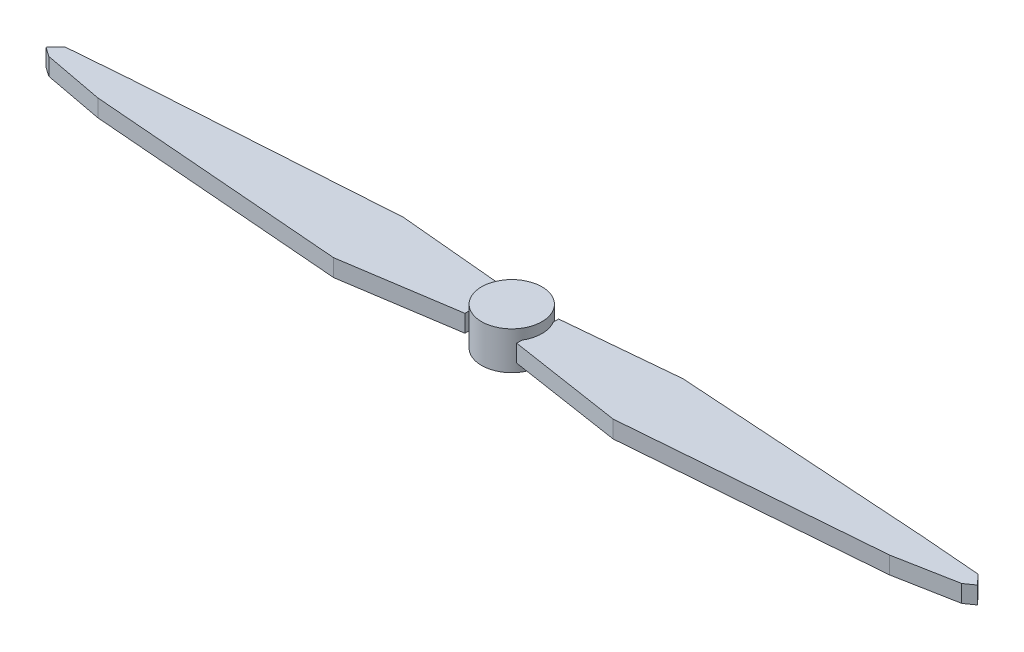
from build123d import *

# Parameters (mm, degrees)
BOSS_EXTRUDE1_DEPTH   = 4
BOSS_EXTRUDE1_2_DEPTH = 4
SKETCH2_R             = 14
BOSS_EXTRUDE2_DEPTH   = 8.8


with BuildPart() as part:
    # Sketch1 → Boss-Extrude1 (new, symmetric)
    with BuildSketch(Plane(origin=(0, 0, 0), x_dir=(1, 0, 0), z_dir=(0, 1, 0))):
        Polygon((12, -9.7155), (64.77, -17.81175), (183.515, -8.31215), (211.582, -3.0226), (215.9, 0), (211.582, 4.5339), (183.515, 6.80085), (64.77, 14.57325), (12, 9.7155), align=None)
    extrude(amount=BOSS_EXTRUDE1_DEPTH, both=True)



with BuildPart() as body_2:
    # Sketch1 → Boss-Extrude1 2 (new, symmetric)
    with BuildSketch(Plane(origin=(0, 0, 0), x_dir=(1, 0, 0), z_dir=(0, 1, 0))):
        Polygon((-12, -9.7155), (-64.77, -17.81175), (-183.515, -8.31215), (-211.582, -3.0226), (-215.9, 0), (-211.582, 4.5339), (-183.515, 6.80085), (-64.77, 14.57325), (-12, 9.7155), align=None)
    extrude(amount=BOSS_EXTRUDE1_2_DEPTH, both=True)


with BuildPart() as part_1:
    add(part.part)

    add(body_2.part)  # Boss-Extrude2 merges body 2
    # Sketch2 → Boss-Extrude2 (add, symmetric)
    with BuildSketch(Plane(origin=(0, 0, 0), x_dir=(1, 0, 0), z_dir=(0, 1, 0))):
        with Locations(Location((0, 0, 0), (0, 0, 270))):
            Circle(SKETCH2_R)
    extrude(amount=BOSS_EXTRUDE2_DEPTH, both=True)


solid = part_1.part
